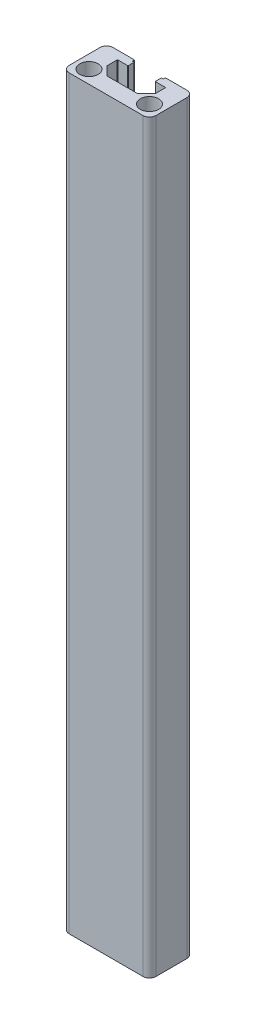
from build123d import *

# Parameters (mm, degrees)
SKETCH_1_R      = 2.1
EXTRUDE_1_DEPTH = 85
FILLET_1_R      = 0.1


with BuildPart() as part:
    # 草图1 → 凸台-拉伸1 (new, symmetric)
    with BuildSketch(Plane(origin=(0, 0, 0), x_dir=(1, 0, 0), z_dir=(0, 1, 0))):
        with BuildLine():
            Line((-3.5, 10), (-3.5, 9.5))
            Line((-3.5, 9.5), (-3.1, 9.5))
            Line((-3.1, 9.5), (-3.1, 8.1))
            Line((-3.1, 8.1), (-5.5, 8.1))
            Line((-5.5, 8.1), (-5.5, 5.701219331))
            Line((-5.5, 5.701219331), (-3.498780669, 3.7))
            Line((-3.498780669, 3.7), (3.498780669, 3.7))
            Line((3.498780669, 3.7), (5.5, 5.701219331))
            Line((5.5, 5.701219331), (5.5, 8.1))
            Line((5.5, 8.1), (3.1, 8.1))
            Line((3.1, 8.1), (3.1, 9.5))
            Line((3.1, 9.5), (3.5, 9.5))
            Line((3.5, 9.5), (3.5, 10))
            Line((3.5, 10), (8.4, 10))
            ThreePointArc((8.4, 10), (9.460660172, 9.560660172), (9.9, 8.5))
            Line((9.9, 8.5), (9.9, 1.5))
            ThreePointArc((9.9, 1.5), (9.460660172, 0.439339828), (8.4, 0))
            Line((8.4, 0), (-8.4, 0))
            ThreePointArc((-8.4, 0), (-9.460660172, 0.439339828), (-9.9, 1.5))
            Line((-9.9, 1.5), (-9.9, 8.5))
            ThreePointArc((-9.9, 8.5), (-9.460660172, 9.560660172), (-8.4, 10))
            Line((-8.4, 10), (-3.5, 10))
        make_face()
        with Locations(Location((-6.9, 3, 0), (0, 0, 270))):
            Circle(SKETCH_1_R, mode=Mode.SUBTRACT)
        with Locations(Location((6.9, 3, 0), (0, 0, 270))):
            Circle(SKETCH_1_R, mode=Mode.SUBTRACT)
    extrude(amount=EXTRUDE_1_DEPTH, both=True)

    # 圆角1
    fillet_1_edges = [part.edges().sort_by_distance(p)[0] for p in [
        (-3.5, 0, -10),
        (-3.5, 0, -9.5),
        (-3.1, 0, -9.5),
        (-3.1, 0, -8.1),
        (-5.5, 0, -8.1),
        (-5.5, 0, -5.701219331),
        (-3.498780669, 0, -3.7),
        (3.498780669, 0, -3.7),
        (5.5, 0, -5.701219331),
        (5.5, 0, -8.1),
        (3.1, 0, -8.1),
        (3.1, 0, -9.5),
        (3.5, 0, -9.5),
        (3.5, 0, -10),
    ]]
    fillet(fillet_1_edges, radius=FILLET_1_R)


solid = part.part
